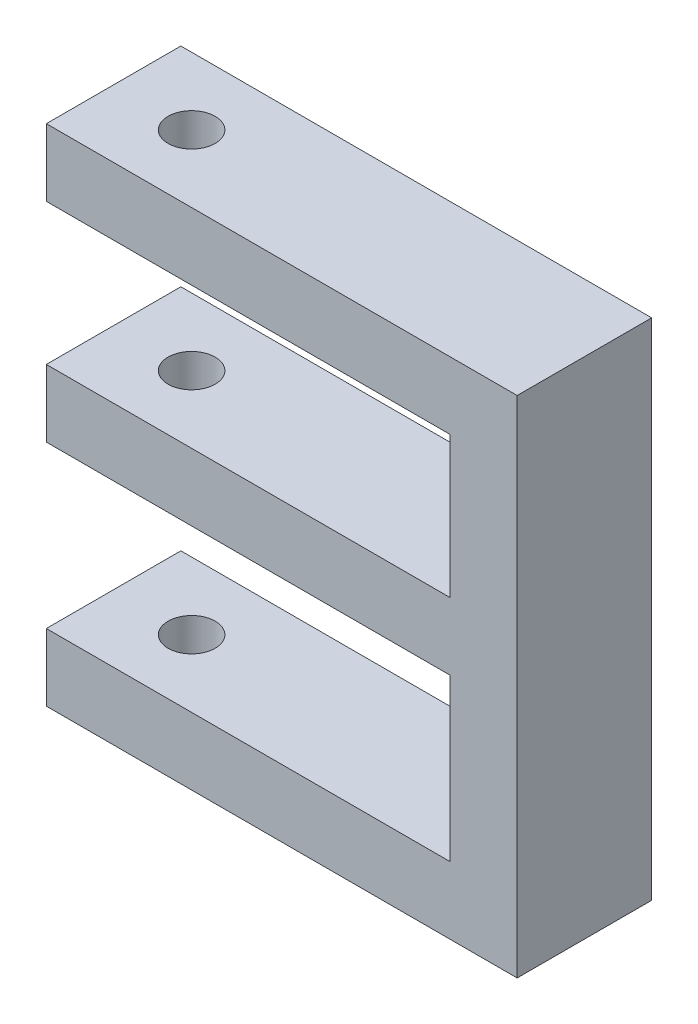
from build123d import *

# Parameters (mm, degrees)
Y_KSEKLIK_EKSTR_ZYON1_DEPTH = 10
IZIM2_R                     = 1.7
KES_EKSTR_ZYON1_DEPTH       = 47
IZIM3_W                     = 10
IZIM3_H                     = 5
Y_KSEKLIK_EKSTR_ZYON2_DEPTH = 30
KES_EKSTR_ZYON2_DEPTH       = 31
KES_EKSTR_ZYON2_DEPTH_BACK  = 31
IZIM4_R                     = 1.75


with BuildPart() as part:
    # Çizim1 → Yükseklik-Ekstrüzyon1 (new body)
    with BuildSketch(Plane.XY):
        Polygon((0, 0), (35, 0), (35, -37.5), (0, -37.5), (0, -32.5), (30, -32.5), (30, -5), (0, -5), align=None)
    extrude(amount=Y_KSEKLIK_EKSTR_ZYON1_DEPTH)

    # Çizim2 → Kes-Ekstrüzyon1 (cut)
    with BuildSketch(Plane(origin=(0, 0, 0), x_dir=(1, 0, 0), z_dir=(0, 1, 0))):
        with Locations(Location((5.8, -5, 0), (0, 0, 270))):
            Circle(IZIM2_R)
    extrude(amount=-KES_EKSTR_ZYON1_DEPTH, mode=Mode.SUBTRACT)

    # Çizim3 → Yükseklik-Ekstrüzyon2 (add)
    with BuildSketch(Plane.ZY.offset(-30)):
        with Locations((5, -18)):
            Rectangle(IZIM3_W, IZIM3_H)
    extrude(amount=Y_KSEKLIK_EKSTR_ZYON2_DEPTH)

    # Çizim4 → Kes-Ekstrüzyon2 (cut, two sides: drawn at the far end of the back side and taken through both)
    with BuildSketch(Plane(origin=(0, -15.5, 0), x_dir=(1, 0, 0), z_dir=(0, 1, 0)).offset(-KES_EKSTR_ZYON2_DEPTH_BACK)):
        with Locations(Location((5.8, -5, 0), (0, 0, 90))):
            Circle(IZIM4_R)
    extrude(amount=KES_EKSTR_ZYON2_DEPTH + KES_EKSTR_ZYON2_DEPTH_BACK, mode=Mode.SUBTRACT)


solid = part.part
